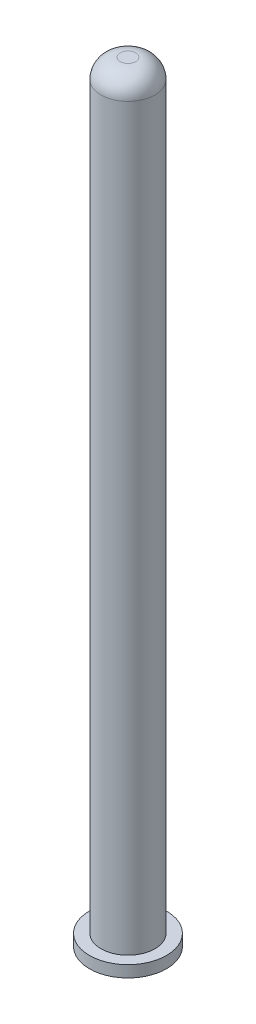
from build123d import *

# Parameters (mm, degrees)
FILLET1_R = 5


with BuildPart() as part:
    # Sketch1 → Revolve1 (revolve)
    with BuildSketch(Plane(origin=(0, 0, 0), x_dir=(0, 0, -1), z_dir=(1, 0, 0)), mode=Mode.PRIVATE) as revolve1_sk:
        Polygon((0, 200), (0, 0), (10, 0), (10, 3), (7, 3), (7, 200), align=None)
    revolve(revolve1_sk.sketch.rotate(Axis((0, 200, 0), (0, -1, 0)), 180), axis=Axis((0, 200, 0), (0, -1, 0)))

    # Fillet1
    fillet1_edges = [part.edges().sort_by_distance(p)[0] for p in [
        (0, 200, -7),
    ]]
    fillet(fillet1_edges, radius=FILLET1_R)


solid = part.part
